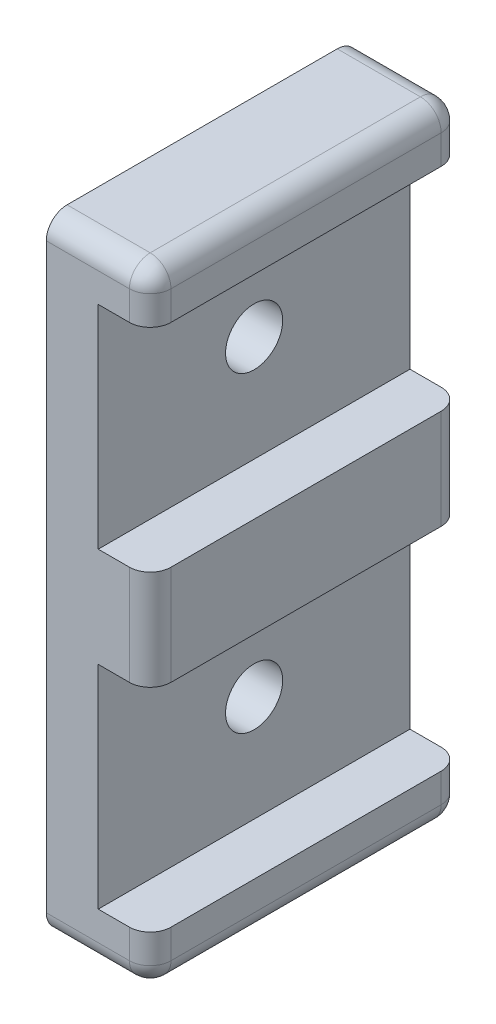
from build123d import *

# Parameters (mm, degrees)
SKETCH_2_R      = 2.75
EXTRUDE_1_DEPTH = 5
EXTRUDE_START   = 5
SKETCH_4_W      = 30
SKETCH_4_H      = 9.6
EXTRUDE_2_DEPTH = 5
FILLET_1_R      = 2


with BuildPart() as part:
    # ｽｹｯﾁ2 → ﾎﾞｽ - 押し出し1 (new body)
    with BuildSketch(Plane(origin=(0, 0, 0), x_dir=(0, 0, -1), z_dir=(1, 0, 0))):
        with BuildLine():
            Line((-15, 28), (-15, -28))
            ThreePointArc((-15, -28), (-14.414213562, -29.414213562), (-13, -30))
            Line((-13, -30), (13, -30))
            ThreePointArc((13, -30), (14.414213562, -29.414213562), (15, -28))
            Line((15, -28), (15, 28))
            ThreePointArc((15, 28), (14.414213562, 29.414213562), (13, 30))
            Line((13, 30), (-13, 30))
            ThreePointArc((-13, 30), (-14.414213562, 29.414213562), (-15, 28))
        make_face()
        with Locations((0, 15)):
            Circle(SKETCH_2_R, mode=Mode.SUBTRACT)
        with Locations((0, -15)):
            Circle(SKETCH_2_R, mode=Mode.SUBTRACT)
    extrude(amount=-EXTRUDE_1_DEPTH)

    # ｽｹｯﾁ4 → ﾎﾞｽ - 押し出し2 (add)
    with BuildSketch(Plane(origin=(0, 0, 0), x_dir=(0, 0, -1), z_dir=(1, 0, 0)).offset(EXTRUDE_START)):
        with BuildLine():
            Line((-15, 28), (-15, 25.2))
            Line((-15, 25.2), (15, 25.2))
            Line((15, 25.2), (15, 28))
            ThreePointArc((15, 28), (14.414213562, 29.414213562), (13, 30))
            Line((13, 30), (-13, 30))
            ThreePointArc((-13, 30), (-14.414213562, 29.414213562), (-15, 28))
        make_face()
        Rectangle(SKETCH_4_W, SKETCH_4_H)
        with BuildLine():
            Line((15, -25.2), (-15, -25.2))
            Line((-15, -25.2), (-15, -28))
            ThreePointArc((-15, -28), (-14.414213562, -29.414213562), (-13, -30))
            Line((-13, -30), (13, -30))
            ThreePointArc((13, -30), (14.414213562, -29.414213562), (15, -28))
            Line((15, -28), (15, -25.2))
        make_face()
    extrude(amount=-EXTRUDE_2_DEPTH)

    # ﾌｨﾚｯﾄ1
    fillet_1_edges = [part.edges().sort_by_distance(p)[0] for p in [
        (5, 26.6, 15),
        (5, 26.6, -15),
        (5, 29.414213562, -14.414213562),
        (5, 30, 0),
        (5, 29.414213562, 14.414213562),
        (5, 0, -15),
        (5, 0, 15),
        (5, -26.6, -15),
        (5, -26.6, 15),
        (5, -29.414213562, 14.414213562),
        (5, -30, 0),
        (5, -29.414213562, -14.414213562),
    ]]
    fillet(fillet_1_edges, radius=FILLET_1_R)


solid = part.part
